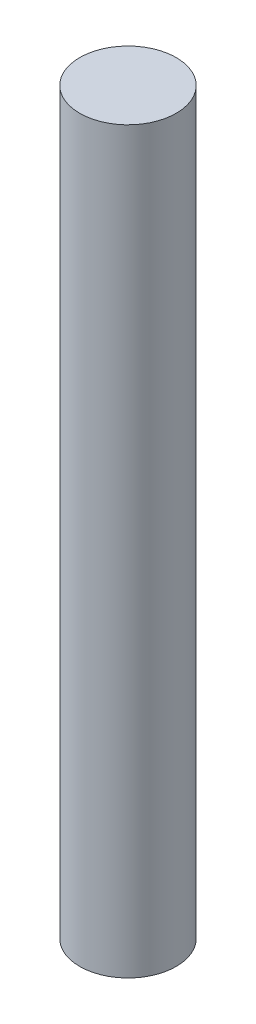
from build123d import *

# Parameters (mm, degrees)
SKETCH_1_R      = 4.9
EXTRUDE_1_DEPTH = 75


with BuildPart() as part:
    # 草图1 → 凸台-拉伸1 (new body)
    with BuildSketch(Plane(origin=(0, 0, 0), x_dir=(1, 0, 0), z_dir=(0, 1, 0))):
        with Locations(Location((0, 0, 0), (0, 0, 270))):
            Circle(SKETCH_1_R)
    extrude(amount=EXTRUDE_1_DEPTH)


solid = part.part
